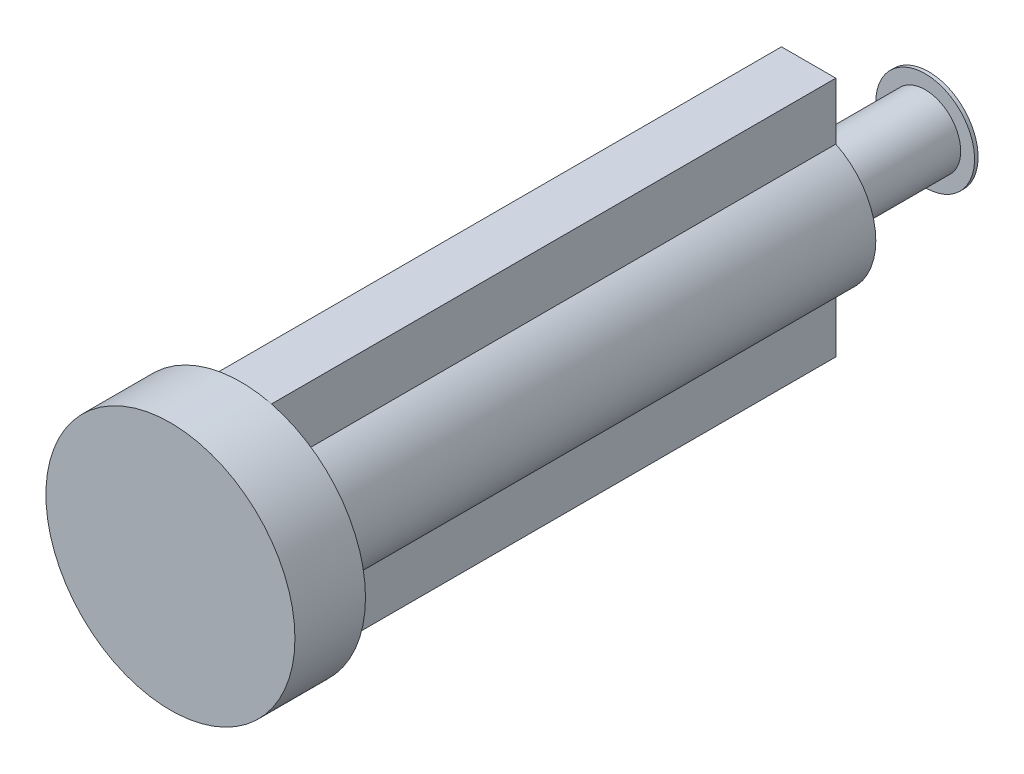
from build123d import *

# Parameters (mm, degrees)
BOSS_EXTRUDE1_DEPTH = 80
SKETCH4_R           = 17.653500843
BOSS_EXTRUDE2_DEPTH = 10
SKETCH5_R           = 5.034978738
BOSS_EXTRUDE3_DEPTH = 17
SKETCH9_R           = 7
BOSS_EXTRUDE6_DEPTH = 0.5


with BuildPart() as part:
    # Sketch3 → Boss-Extrude1 (new body)
    with BuildSketch(Plane.XY):
        with BuildLine():
            Line((-3.371320853, -9.414573581), (-3.371320853, -17.114573581))
            Line((-3.371320853, -17.114573581), (4.328679147, -17.114573581))
            Line((4.328679147, -17.114573581), (4.328679147, -9.014573581))
            ThreePointArc((4.328679147, -9.014573581), (10, 0), (4.328679147, 9.014573581))
            Line((4.328679147, 9.014573581), (4.328679147, 17.114573581))
            Line((4.328679147, 17.114573581), (-3.371320853, 17.114573581))
            Line((-3.371320853, 17.114573581), (-3.371320853, 9.414573581))
            ThreePointArc((-3.371320853, 9.414573581), (-10, 0), (-3.371320853, -9.414573581))
        make_face()
    extrude(amount=BOSS_EXTRUDE1_DEPTH)

    # Sketch4 → Boss-Extrude2 (add)
    with BuildSketch(Plane.XY.offset(80)):
        with Locations(Location((0, 0, 0), (0, 0, 284.1937898))):
            Circle(SKETCH4_R)
    extrude(amount=BOSS_EXTRUDE2_DEPTH)

    # Sketch5 → Boss-Extrude3 (add)
    with BuildSketch(Plane(origin=(0, 0, 0), x_dir=(-1, 0, 0), z_dir=(0, 0, -1))):
        with Locations(Location((0, 0, 0), (0, 0, 180))):
            Circle(SKETCH5_R)
    extrude(amount=BOSS_EXTRUDE3_DEPTH)

    # Sketch9 → Boss-Extrude6 (add)
    with BuildSketch(Plane(origin=(0, 0, -17), x_dir=(-1, 0, 0), z_dir=(0, 0, -1))):
        Circle(SKETCH9_R)
    extrude(amount=BOSS_EXTRUDE6_DEPTH)


solid = part.part
